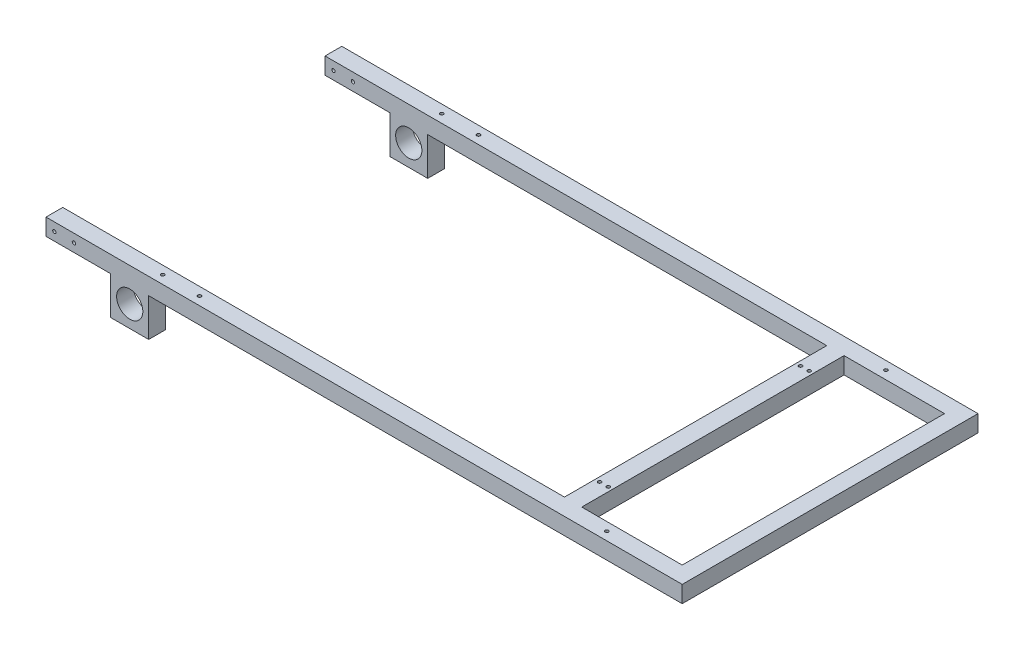
from build123d import *

# Parameters (mm, degrees)
SKETCH_1_W          = 1980
SKETCH_1_H          = 530
SKETCH_1_W_2        = 1920
SKETCH_1_H_2        = 470
EXTRUDE_1_DEPTH     = 30
SKETCH_2_W          = 68
SKETCH_2_H          = 30
EXTRUDE_2_DEPTH     = 68
SKETCH_3_R          = 23.5
CUT_EXTRUDE_1_DEPTH = 1125.999555555
SKETCH_4_W          = 31
SKETCH_4_H          = 470
EXTRUDE_3_DEPTH     = 30
SKETCH_5_R          = 3
CUT_EXTRUDE_2_DEPTH = 1030.528532873
SKETCH_6_R          = 3
CUT_EXTRUDE_3_DEPTH = 1030.528532873
SKETCH_7_W          = 917.525313644
SKETCH_7_H          = 30
CUT_EXTRUDE_4_DEPTH = 1125.999555555
SKETCH_8_R          = 3
CUT_EXTRUDE_5_DEPTH = 1125.999555555
SKETCH_9_R          = 3
CUT_EXTRUDE_6_DEPTH = 1028.107102497
SKETCH_10_R         = 3
CUT_EXTRUDE_7_DEPTH = 1125.999555555


with BuildPart() as part:
    # 草图1 → 凸台-拉伸1 (new body)
    with BuildSketch(Plane(origin=(0, 0, 0), x_dir=(1, 0, 0), z_dir=(0, 1, 0))):
        Rectangle(SKETCH_1_W, SKETCH_1_H)
        Rectangle(SKETCH_1_W_2, SKETCH_1_H_2, mode=Mode.SUBTRACT)
    extrude(amount=EXTRUDE_1_DEPTH)

    # 草图2 → 凸台-拉伸2 (add)
    with BuildSketch(Plane.XZ):
        with Locations((0, 250)):
            Rectangle(SKETCH_2_W, SKETCH_2_H)
        with Locations((0, -250)):
            Rectangle(SKETCH_2_W, SKETCH_2_H)
    extrude(amount=EXTRUDE_2_DEPTH)

    # 草图3 → 切除-拉伸1 (cut, through all)
    with BuildSketch(Plane.XY.offset(265)):
        with Locations((0, -30)):
            Circle(SKETCH_3_R)
    extrude(amount=-CUT_EXTRUDE_1_DEPTH, mode=Mode.SUBTRACT)

    # 草图4 → 凸台-拉伸3 (add)
    with BuildSketch(Plane(origin=(0, 30, 0), x_dir=(1, 0, 0), z_dir=(0, 1, 0))):
        with Locations((764.5, 0)):
            Rectangle(SKETCH_4_W, SKETCH_4_H)
    extrude(amount=-EXTRUDE_3_DEPTH)

    # 草图5 → 切除-拉伸2 (cut, through all)
    with BuildSketch(Plane(origin=(0, 30, 0), x_dir=(1, 0, 0), z_dir=(0, 1, 0))):
        with Locations(Location((757, 180, 0), (0, 0, 270))):
            Circle(SKETCH_5_R)
        with Locations(Location((772.5, 180, 0), (0, 0, 270))):
            Circle(SKETCH_5_R)
        with Locations(Location((757, -180, 0), (0, 0, 270))):
            Circle(SKETCH_5_R)
        with Locations(Location((772.5, -180, 0), (0, 0, 270))):
            Circle(SKETCH_5_R)
    extrude(amount=-CUT_EXTRUDE_2_DEPTH, mode=Mode.SUBTRACT)

    # 草图6 → 切除-拉伸3 (cut, symmetric)
    with BuildSketch(Plane(origin=(0, 30, 0), x_dir=(1, 0, 0), z_dir=(0, 1, 0))):
        with Locations(Location((840, -250, 0), (0, 0, 270))):
            Circle(SKETCH_6_R)
    cut_extrude_3 = extrude(amount=CUT_EXTRUDE_3_DEPTH, both=True, mode=Mode.SUBTRACT)

    # 镜向1: 切除-拉伸3 across plane
    add(cut_extrude_3.mirror(Plane.XY), mode=Mode.SUBTRACT)

    # 草图7 → 切除-拉伸4 (cut, through all)
    with BuildSketch(Plane.XY.offset(265)):
        with Locations((-608.762656822, 15)):
            Rectangle(SKETCH_7_W, SKETCH_7_H)
    extrude(amount=-CUT_EXTRUDE_4_DEPTH, mode=Mode.SUBTRACT)

    # 草图8 → 切除-拉伸5 (cut, through all)
    with BuildSketch(Plane.XY.offset(265)):
        with Locations((-100, 15)):
            Circle(SKETCH_8_R)
    extrude(amount=-CUT_EXTRUDE_5_DEPTH, mode=Mode.SUBTRACT)

    # 草图9 → 切除-拉伸6 (cut, through all)
    with BuildSketch(Plane.XZ):
        with Locations(Location((110, 250, 0), (0, 0, 270))):
            Circle(SKETCH_9_R)
        with Locations(Location((44, 250, 0), (0, 0, 270))):
            Circle(SKETCH_9_R)
    cut_extrude_6 = extrude(amount=-CUT_EXTRUDE_6_DEPTH, mode=Mode.SUBTRACT)

    # 镜向2: 切除-拉伸6 across plane
    add(cut_extrude_6.mirror(Plane.XY), mode=Mode.SUBTRACT)

    # 草图10 → 切除-拉伸7 (cut, through all)
    with BuildSketch(Plane.XY.offset(265)):
        with Locations((-135, 15)):
            Circle(SKETCH_10_R)
    extrude(amount=-CUT_EXTRUDE_7_DEPTH, mode=Mode.SUBTRACT)


solid = part.part
